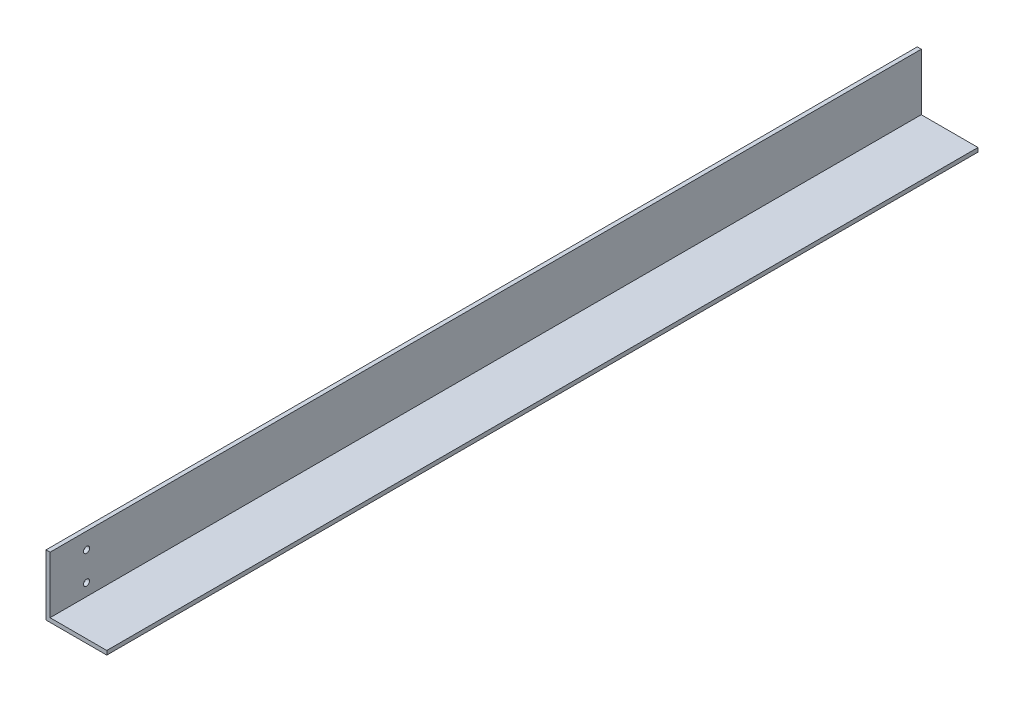
from build123d import *

# Parameters (mm, degrees)
BOSS_EXTRUDE1_DEPTH      = 410
BOSS_EXTRUDE1_DEPTH_BACK = 20
F_3_0_3_DIAMETER_HOLE1_D = 3


with BuildPart() as part:
    # Sketch1 → Boss-Extrude1 (new, two sides: drawn at the far end of the back side and taken through both)
    with BuildSketch(Plane.XY.offset(-BOSS_EXTRUDE1_DEPTH_BACK)):
        Polygon((0, 5.602318429), (0, 35.602318429), (2, 35.602318429), (2, 7.602318429), (30, 7.602318429), (30, 5.602318429), align=None)
    extrude(amount=BOSS_EXTRUDE1_DEPTH + BOSS_EXTRUDE1_DEPTH_BACK)

    # Ø3.0 (3) Diameter Hole1 (through all)
    with Locations(Plane(origin=(0, 136.46431451, 221.32004832), x_dir=(0, 1, 0), z_dir=(-1, 0, 0))):
        with Locations((-122.861996081, -170.67995168), (-108.861996081, -170.67995168), (215.138003919, -170.67995168), (201.138003919, -170.67995168)):
            Hole(F_3_0_3_DIAMETER_HOLE1_D / 2)


solid = part.part
